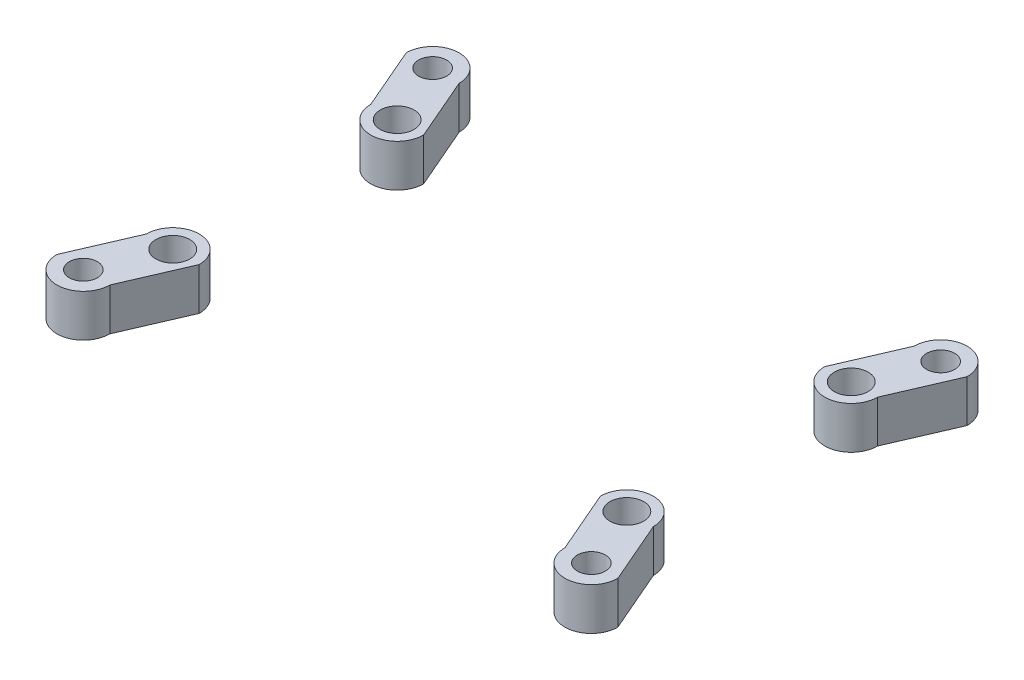
from build123d import *

# Parameters (mm, degrees)
BOSS_EXTRUDE1_DEPTH     = 4
BOSS_EXTRUDE1_2_DEPTH   = 4
BOSS_EXTRUDE1_3_DEPTH   = 4
BOSS_EXTRUDE1_4_DEPTH   = 4
CUT_EXTRUDE1_DEPTH      = 33.851940582
CUT_EXTRUDE1_DEPTH_BACK = 33.851940582
SKETCH1_R               = 1.325
CUT_EXTRUDE2_DEPTH      = 33.851940582
CUT_EXTRUDE2_DEPTH_BACK = 33.851940582
SKETCH4_R               = 1.6


with BuildPart() as part:
    # Sketch5 → Boss-Extrude1 (new body)
    with BuildSketch(Plane(origin=(0, 0, 0), x_dir=(1, 0, 0), z_dir=(0, 1, 0))):
        with BuildLine():
            Line((-26.5, 16.5), (-23.95, 10.6))
            ThreePointArc((-23.95, 10.6), (-21.45, 8.1), (-18.95, 10.6))
            Line((-18.95, 10.6), (-21.5, 16.5))
            ThreePointArc((-21.5, 16.5), (-24, 19), (-26.5, 16.5))
        make_face()
    extrude(amount=BOSS_EXTRUDE1_DEPTH)


with BuildPart() as body_2:
    # Sketch5 → Boss-Extrude1 2 (new body)
    with BuildSketch(Plane(origin=(0, 0, 0), x_dir=(1, 0, 0), z_dir=(0, 1, 0))):
        with BuildLine():
            Line((21.5, 16.5), (18.95, 10.6))
            ThreePointArc((18.95, 10.6), (21.45, 8.1), (23.95, 10.6))
            Line((23.95, 10.6), (26.5, 16.5))
            ThreePointArc((26.5, 16.5), (24, 19), (21.5, 16.5))
        make_face()
    extrude(amount=BOSS_EXTRUDE1_2_DEPTH)


with BuildPart() as body_3:
    # Sketch5 → Boss-Extrude1 3 (new body)
    with BuildSketch(Plane(origin=(0, 0, 0), x_dir=(1, 0, 0), z_dir=(0, 1, 0))):
        with BuildLine():
            Line((26.5, -16.5), (23.95, -10.6))
            ThreePointArc((23.95, -10.6), (21.45, -8.1), (18.95, -10.6))
            Line((18.95, -10.6), (21.5, -16.5))
            ThreePointArc((21.5, -16.5), (24, -19), (26.5, -16.5))
        make_face()
    extrude(amount=BOSS_EXTRUDE1_3_DEPTH)


with BuildPart() as body_4:
    # Sketch5 → Boss-Extrude1 4 (new body)
    with BuildSketch(Plane(origin=(0, 0, 0), x_dir=(1, 0, 0), z_dir=(0, 1, 0))):
        with BuildLine():
            Line((-21.5, -16.5), (-18.95, -10.6))
            ThreePointArc((-18.95, -10.6), (-21.45, -8.1), (-23.95, -10.6))
            Line((-23.95, -10.6), (-26.5, -16.5))
            ThreePointArc((-26.5, -16.5), (-24, -19), (-21.5, -16.5))
        make_face()
    extrude(amount=BOSS_EXTRUDE1_4_DEPTH)


with BuildPart() as cut_extrude1_tool:
    # Sketch1 → Cut-Extrude1 (new, two sides: drawn at the far end of the back side and taken through both)
    with BuildSketch(Plane(origin=(0, 0, 0), x_dir=(1, 0, 0), z_dir=(0, 1, 0)).offset(-CUT_EXTRUDE1_DEPTH_BACK)):
        with Locations(Location((-24, 16.5, 0), (0, 0, 270))):
            Circle(SKETCH1_R)
        with Locations(Location((24, 16.5, 0), (0, 0, 90))):
            Circle(SKETCH1_R)
        with Locations(Location((-24, -16.5, 0), (0, 0, 90))):
            Circle(SKETCH1_R)
        with Locations(Location((24, -16.5, 0), (0, 0, 270))):
            Circle(SKETCH1_R)
    extrude(amount=CUT_EXTRUDE1_DEPTH + CUT_EXTRUDE1_DEPTH_BACK)


with BuildPart() as part_1:
    add(part.part)

    # Cut-Extrude1: cut by cut_extrude1_tool
    add(cut_extrude1_tool.part, mode=Mode.SUBTRACT)


with BuildPart() as body_2_1:
    add(body_2.part)

    # Cut-Extrude1: cut by cut_extrude1_tool
    add(cut_extrude1_tool.part, mode=Mode.SUBTRACT)


with BuildPart() as body_3_1:
    add(body_3.part)

    # Cut-Extrude1: cut by cut_extrude1_tool
    add(cut_extrude1_tool.part, mode=Mode.SUBTRACT)


with BuildPart() as body_4_1:
    add(body_4.part)

    # Cut-Extrude1: cut by cut_extrude1_tool
    add(cut_extrude1_tool.part, mode=Mode.SUBTRACT)


with BuildPart() as cut_extrude2_tool:
    # Sketch4 → Cut-Extrude2 (new, two sides: drawn at the far end of the back side and taken through both)
    with BuildSketch(Plane(origin=(0, 0, 0), x_dir=(1, 0, 0), z_dir=(0, 1, 0)).offset(-CUT_EXTRUDE2_DEPTH_BACK)):
        with Locations(Location((-21.45, 10.6, 0), (0, 0, 270))):
            Circle(SKETCH4_R)
        with Locations(Location((21.45, 10.6, 0), (0, 0, 90))):
            Circle(SKETCH4_R)
        with Locations(Location((-21.45, -10.6, 0), (0, 0, 90))):
            Circle(SKETCH4_R)
        with Locations(Location((21.45, -10.6, 0), (0, 0, 270))):
            Circle(SKETCH4_R)
    extrude(amount=CUT_EXTRUDE2_DEPTH + CUT_EXTRUDE2_DEPTH_BACK)


with BuildPart() as part_2:
    add(part_1.part)

    # Cut-Extrude2: cut by cut_extrude2_tool
    add(cut_extrude2_tool.part, mode=Mode.SUBTRACT)


with BuildPart() as body_2_2:
    add(body_2_1.part)

    # Cut-Extrude2: cut by cut_extrude2_tool
    add(cut_extrude2_tool.part, mode=Mode.SUBTRACT)


with BuildPart() as body_3_2:
    add(body_3_1.part)

    # Cut-Extrude2: cut by cut_extrude2_tool
    add(cut_extrude2_tool.part, mode=Mode.SUBTRACT)


with BuildPart() as body_4_2:
    add(body_4_1.part)

    # Cut-Extrude2: cut by cut_extrude2_tool
    add(cut_extrude2_tool.part, mode=Mode.SUBTRACT)


solid = Compound([part_2.part, body_2_2.part, body_3_2.part, body_4_2.part])
